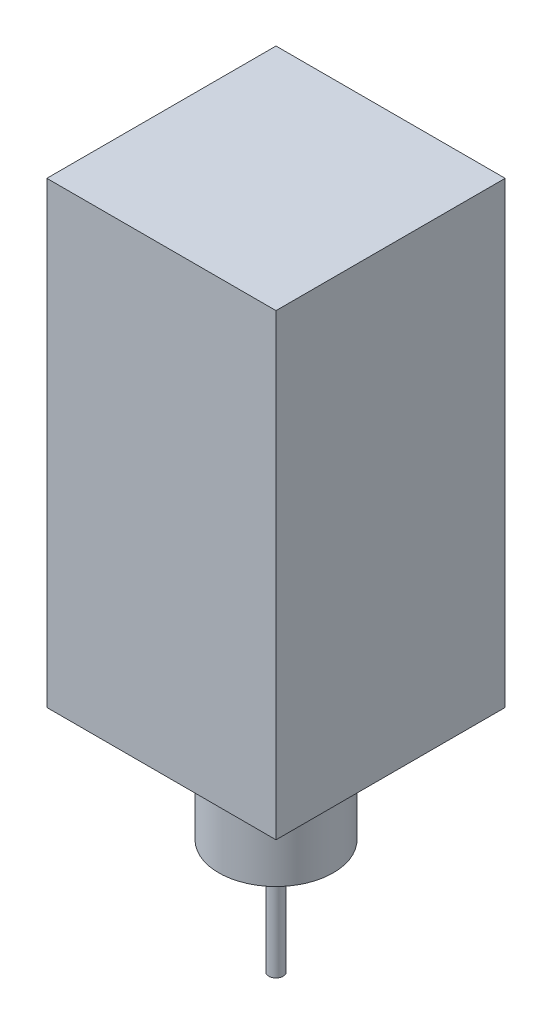
from build123d import *

# Parameters (mm, degrees)
SKETCH1_W           = 100
SKETCH1_H           = 100
BOSS_EXTRUDE1_DEPTH = 200
SKETCH2_R           = 25
BOSS_EXTRUDE2_DEPTH = 50
SKETCH3_R           = 3.15
BOSS_EXTRUDE3_DEPTH = 50


with BuildPart() as part:
    # Sketch1 → Boss-Extrude1 (new body)
    with BuildSketch(Plane(origin=(0, 0, 0), x_dir=(1, 0, 0), z_dir=(0, 1, 0))):
        with Locations((50, 50)):
            Rectangle(SKETCH1_W, SKETCH1_H)
    extrude(amount=BOSS_EXTRUDE1_DEPTH)

    # Sketch2 → Boss-Extrude2 (add)
    with BuildSketch(Plane.XZ):
        with Locations(Location((50, -50, 0), (0, 0, 270))):
            Circle(SKETCH2_R)
    extrude(amount=BOSS_EXTRUDE2_DEPTH)

    # Sketch3 → Boss-Extrude3 (add)
    with BuildSketch(Plane.XZ.offset(50)):
        with Locations(Location((50, -50, 0), (0, 0, 270))):
            Circle(SKETCH3_R)
    extrude(amount=BOSS_EXTRUDE3_DEPTH)


solid = part.part
